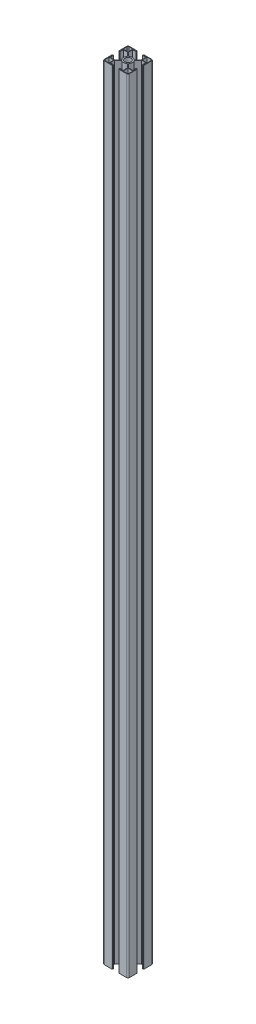
from build123d import *

# Parameters (mm, degrees)
ESBO_O1_R                = 5
RESSALTO_EXTRUS_O1_DEPTH = 1250
ESBO_O4_W                = 0.75
ESBO_O4_H                = 0.5
ESBO_O4_W_2              = 0.5
ESBO_O4_H_2              = 0.75
CORTE_EXTRUS_O1_DEPTH    = 1250


with BuildPart() as part:
    # Esboço1 → Ressalto-extrusão1 (new body)
    with BuildSketch(Plane(origin=(0, 0, 0), x_dir=(1, 0, 0), z_dir=(0, 1, 0))):
        with BuildLine():
            Line((-18, -20), (-5, -20))
            Line((-5, -20), (-5, -18))
            Line((-5, -18), (-10.5, -18))
            Line((-10.5, -18), (-10.5, -11.206655676))
            Line((-10.5, -11.206655676), (-4.583792723, -5.2904484))
            ThreePointArc((-4.583792723, -5.2904484), (0, -7), (4.583792723, -5.2904484))
            Line((4.583792723, -5.2904484), (10.5, -11.206655676))
            Line((10.5, -11.206655676), (10.5, -18))
            Line((10.5, -18), (5, -18))
            Line((5, -18), (5, -20))
            Line((5, -20), (18, -20))
            ThreePointArc((18, -20), (19.414213562, -19.414213562), (20, -18))
            Line((20, -18), (20, -5))
            Line((20, -5), (18, -5))
            Line((18, -5), (18, -10.5))
            Line((18, -10.5), (11.206655676, -10.5))
            Line((11.206655676, -10.5), (5.2904484, -4.583792723))
            ThreePointArc((5.2904484, -4.583792723), (7, 0), (5.2904484, 4.583792723))
            Line((5.2904484, 4.583792723), (11.206655676, 10.5))
            Line((11.206655676, 10.5), (18, 10.5))
            Line((18, 10.5), (18, 5))
            Line((18, 5), (20, 5))
            Line((20, 5), (20, 18))
            ThreePointArc((20, 18), (19.414213562, 19.414213562), (18, 20))
            Line((18, 20), (5, 20))
            Line((5, 20), (5, 18))
            Line((5, 18), (10.5, 18))
            Line((10.5, 18), (10.5, 11.206655676))
            Line((10.5, 11.206655676), (4.583792723, 5.2904484))
            ThreePointArc((4.583792723, 5.2904484), (0, 7), (-4.583792723, 5.2904484))
            Line((-4.583792723, 5.2904484), (-10.5, 11.206655676))
            Line((-10.5, 11.206655676), (-10.5, 18))
            Line((-10.5, 18), (-5, 18))
            Line((-5, 18), (-5, 20))
            Line((-5, 20), (-18, 20))
            ThreePointArc((-18, 20), (-19.414213562, 19.414213562), (-20, 18))
            Line((-20, 18), (-20, 5))
            Line((-20, 5), (-18, 5))
            Line((-18, 5), (-18, 10.5))
            Line((-18, 10.5), (-11.206655676, 10.5))
            Line((-11.206655676, 10.5), (-5.2904484, 4.583792723))
            ThreePointArc((-5.2904484, 4.583792723), (-7, 0), (-5.2904484, -4.583792723))
            Line((-5.2904484, -4.583792723), (-11.206655676, -10.5))
            Line((-11.206655676, -10.5), (-18, -10.5))
            Line((-18, -10.5), (-18, -5))
            Line((-18, -5), (-20, -5))
            Line((-20, -5), (-20, -18))
            ThreePointArc((-20, -18), (-19.414213562, -19.414213562), (-18, -20))
        make_face()
        with Locations(Location((0, 0, 0), (0, 0, 270))):
            Circle(ESBO_O1_R, mode=Mode.SUBTRACT)
        with BuildLine():
            Line((-19.25, 5.75), (-18.75, 5.75))
            Line((-18.75, 5.75), (-18.75, 11.25))
            Line((-18.75, 11.25), (-11.25, 11.25))
            Line((-11.25, 11.25), (-11.25, 18.75))
            Line((-11.25, 18.75), (-5.75, 18.75))
            Line((-5.75, 18.75), (-5.75, 19.25))
            Line((-5.75, 19.25), (-17.469669914, 19.25))
            ThreePointArc((-17.469669914, 19.25), (-18.728553391, 18.728553391), (-19.25, 17.469669914))
            Line((-19.25, 17.469669914), (-19.25, 5.75))
        make_face(mode=Mode.SUBTRACT)
        with BuildLine():
            Line((19.25, 5.75), (19.25, 17.469669914))
            ThreePointArc((19.25, 17.469669914), (18.728553391, 18.728553391), (17.469669914, 19.25))
            Line((17.469669914, 19.25), (5.75, 19.25))
            Line((5.75, 19.25), (5.75, 18.75))
            Line((5.75, 18.75), (11.25, 18.75))
            Line((11.25, 18.75), (11.25, 11.25))
            Line((11.25, 11.25), (18.75, 11.25))
            Line((18.75, 11.25), (18.75, 5.75))
            Line((18.75, 5.75), (19.25, 5.75))
        make_face(mode=Mode.SUBTRACT)
        with BuildLine():
            Line((19.25, -5.75), (18.75, -5.75))
            Line((18.75, -5.75), (18.75, -11.25))
            Line((18.75, -11.25), (11.25, -11.25))
            Line((11.25, -11.25), (11.25, -18.75))
            Line((11.25, -18.75), (5.75, -18.75))
            Line((5.75, -18.75), (5.75, -19.25))
            Line((5.75, -19.25), (17.469669914, -19.25))
            ThreePointArc((17.469669914, -19.25), (18.728553391, -18.728553391), (19.25, -17.469669914))
            Line((19.25, -17.469669914), (19.25, -5.75))
        make_face(mode=Mode.SUBTRACT)
        with BuildLine():
            Line((-19.25, -5.75), (-19.25, -17.469669914))
            ThreePointArc((-19.25, -17.469669914), (-18.728553391, -18.728553391), (-17.469669914, -19.25))
            Line((-17.469669914, -19.25), (-5.75, -19.25))
            Line((-5.75, -19.25), (-5.75, -18.75))
            Line((-5.75, -18.75), (-11.25, -18.75))
            Line((-11.25, -18.75), (-11.25, -11.25))
            Line((-11.25, -11.25), (-18.75, -11.25))
            Line((-18.75, -11.25), (-18.75, -5.75))
            Line((-18.75, -5.75), (-19.25, -5.75))
        make_face(mode=Mode.SUBTRACT)
    extrude(amount=RESSALTO_EXTRUS_O1_DEPTH)

    # Esboço4 → Corte-extrusão1 (cut)
    with BuildSketch(Plane(origin=(0, 1250, 0), x_dir=(1, 0, 0), z_dir=(0, 1, 0))):
        with Locations((-5.375, 19.75)):
            Rectangle(ESBO_O4_W, ESBO_O4_H)
        with Locations((19.75, 5.375)):
            Rectangle(ESBO_O4_W_2, ESBO_O4_H_2)
        with Locations((-19.75, 5.375)):
            Rectangle(ESBO_O4_W_2, ESBO_O4_H_2)
        with Locations((5.375, 19.75)):
            Rectangle(ESBO_O4_W, ESBO_O4_H)
        with Locations((5.375, -19.75)):
            Rectangle(ESBO_O4_W, ESBO_O4_H)
        with Locations((19.75, -5.375)):
            Rectangle(ESBO_O4_W_2, ESBO_O4_H_2)
        with Locations((-19.75, -5.375)):
            Rectangle(ESBO_O4_W_2, ESBO_O4_H_2)
        with Locations((-5.375, -19.75)):
            Rectangle(ESBO_O4_W, ESBO_O4_H)
    extrude(amount=-CORTE_EXTRUS_O1_DEPTH, mode=Mode.SUBTRACT)


solid = part.part
